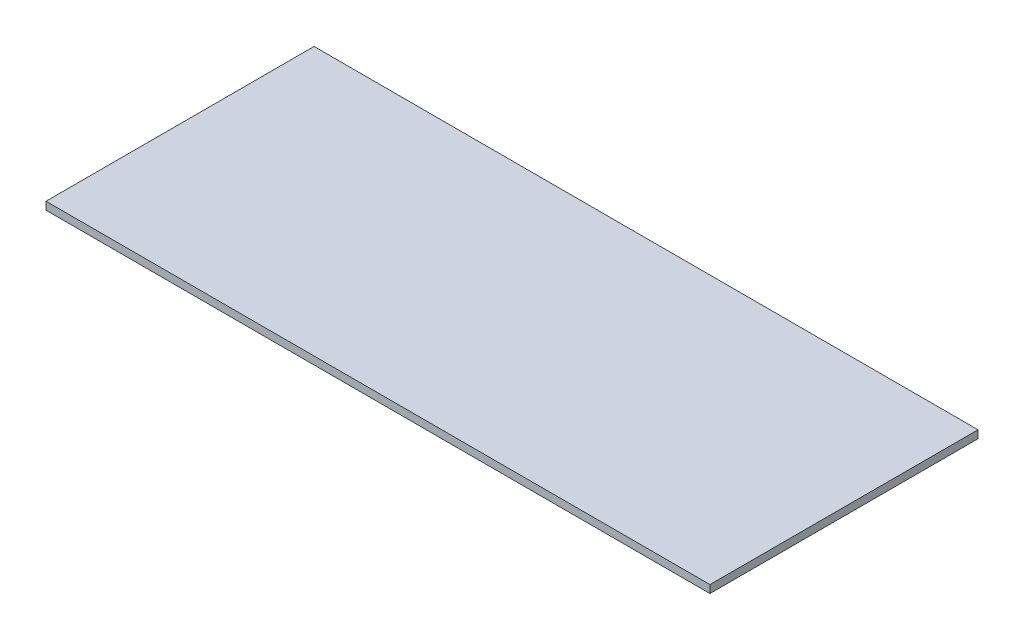
from build123d import *

# Parameters (mm, degrees)
SKETCH1_W           = 406.4
SKETCH1_H           = 164.084
BOSS_EXTRUDE1_DEPTH = 4.7625


with BuildPart() as part:
    # Sketch1 → Boss-Extrude1 (new body)
    with BuildSketch(Plane(origin=(0, 0, 0), x_dir=(1, 0, 0), z_dir=(0, 1, 0))):
        with Locations((203.2, 82.042)):
            Rectangle(SKETCH1_W, SKETCH1_H)
    extrude(amount=BOSS_EXTRUDE1_DEPTH)


solid = part.part
